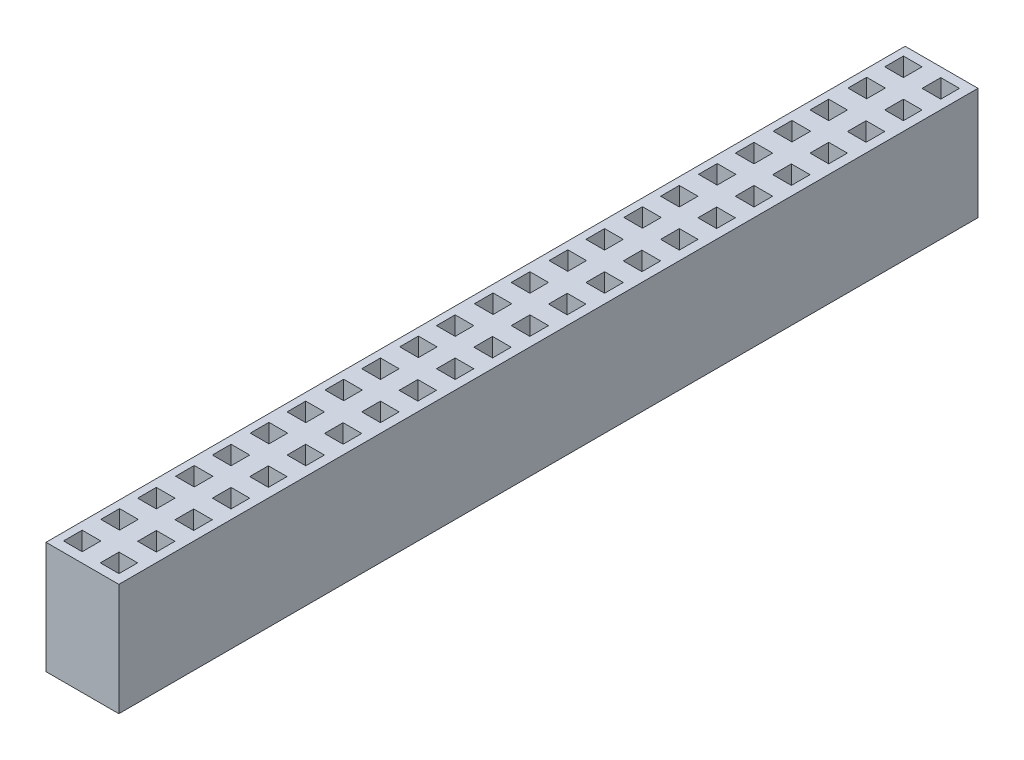
from build123d import *

# Parameters (mm, degrees)
SKETCH1_W           = 4.953
SKETCH1_H           = 58.42
SKETCH1_W_2         = 1.27
SKETCH1_H_2         = 1.27
BOSS_EXTRUDE1_DEPTH = 7.62


with BuildPart() as part:
    # Sketch1 → Boss-Extrude1 (new body)
    with BuildSketch(Plane(origin=(0, 0, 0), x_dir=(1, 0, 0), z_dir=(0, 1, 0))):
        with Locations((2.4765, 29.21)):
            Rectangle(SKETCH1_W, SKETCH1_H)
        with Locations((3.691399704, 57.15)):
            Rectangle(SKETCH1_W_2, SKETCH1_H_2, mode=Mode.SUBTRACT)
        with Locations((1.151399704, 57.15)):
            Rectangle(SKETCH1_W_2, SKETCH1_H_2, mode=Mode.SUBTRACT)
        with Locations((3.691399704, 54.61)):
            Rectangle(SKETCH1_W_2, SKETCH1_H_2, mode=Mode.SUBTRACT)
        with Locations((1.151399704, 54.648853122)):
            Rectangle(SKETCH1_W_2, SKETCH1_H_2, mode=Mode.SUBTRACT)
        with Locations((3.691399704, 52.07)):
            Rectangle(SKETCH1_W_2, SKETCH1_H_2, mode=Mode.SUBTRACT)
        with Locations((1.151399704, 52.07)):
            Rectangle(SKETCH1_W_2, SKETCH1_H_2, mode=Mode.SUBTRACT)
        with Locations((3.691399704, 49.53)):
            Rectangle(SKETCH1_W_2, SKETCH1_H_2, mode=Mode.SUBTRACT)
        with Locations((1.151399704, 49.568853122)):
            Rectangle(SKETCH1_W_2, SKETCH1_H_2, mode=Mode.SUBTRACT)
        with Locations((3.691399704, 46.99)):
            Rectangle(SKETCH1_W_2, SKETCH1_H_2, mode=Mode.SUBTRACT)
        with Locations((1.151399704, 46.99)):
            Rectangle(SKETCH1_W_2, SKETCH1_H_2, mode=Mode.SUBTRACT)
        with Locations((3.691399704, 44.45)):
            Rectangle(SKETCH1_W_2, SKETCH1_H_2, mode=Mode.SUBTRACT)
        with Locations((1.151399704, 44.488853122)):
            Rectangle(SKETCH1_W_2, SKETCH1_H_2, mode=Mode.SUBTRACT)
        with Locations((3.691399704, 41.91)):
            Rectangle(SKETCH1_W_2, SKETCH1_H_2, mode=Mode.SUBTRACT)
        with Locations((1.151399704, 41.91)):
            Rectangle(SKETCH1_W_2, SKETCH1_H_2, mode=Mode.SUBTRACT)
        with Locations((3.691399704, 39.37)):
            Rectangle(SKETCH1_W_2, SKETCH1_H_2, mode=Mode.SUBTRACT)
        with Locations((1.151399704, 39.408853122)):
            Rectangle(SKETCH1_W_2, SKETCH1_H_2, mode=Mode.SUBTRACT)
        with Locations((3.691399704, 36.83)):
            Rectangle(SKETCH1_W_2, SKETCH1_H_2, mode=Mode.SUBTRACT)
        with Locations((1.151399704, 36.83)):
            Rectangle(SKETCH1_W_2, SKETCH1_H_2, mode=Mode.SUBTRACT)
        with Locations((3.691399704, 34.29)):
            Rectangle(SKETCH1_W_2, SKETCH1_H_2, mode=Mode.SUBTRACT)
        with Locations((1.151399704, 34.328853122)):
            Rectangle(SKETCH1_W_2, SKETCH1_H_2, mode=Mode.SUBTRACT)
        with Locations((3.691399704, 31.75)):
            Rectangle(SKETCH1_W_2, SKETCH1_H_2, mode=Mode.SUBTRACT)
        with Locations((1.151399704, 31.75)):
            Rectangle(SKETCH1_W_2, SKETCH1_H_2, mode=Mode.SUBTRACT)
        with Locations((3.691399704, 29.21)):
            Rectangle(SKETCH1_W_2, SKETCH1_H_2, mode=Mode.SUBTRACT)
        with Locations((1.151399704, 29.248853122)):
            Rectangle(SKETCH1_W_2, SKETCH1_H_2, mode=Mode.SUBTRACT)
        with Locations((3.691399704, 26.67)):
            Rectangle(SKETCH1_W_2, SKETCH1_H_2, mode=Mode.SUBTRACT)
        with Locations((1.151399704, 26.67)):
            Rectangle(SKETCH1_W_2, SKETCH1_H_2, mode=Mode.SUBTRACT)
        with Locations((3.691399704, 24.13)):
            Rectangle(SKETCH1_W_2, SKETCH1_H_2, mode=Mode.SUBTRACT)
        with Locations((1.151399704, 24.168853122)):
            Rectangle(SKETCH1_W_2, SKETCH1_H_2, mode=Mode.SUBTRACT)
        with Locations((3.691399704, 21.59)):
            Rectangle(SKETCH1_W_2, SKETCH1_H_2, mode=Mode.SUBTRACT)
        with Locations((1.151399704, 21.59)):
            Rectangle(SKETCH1_W_2, SKETCH1_H_2, mode=Mode.SUBTRACT)
        with Locations((3.691399704, 19.05)):
            Rectangle(SKETCH1_W_2, SKETCH1_H_2, mode=Mode.SUBTRACT)
        with Locations((1.151399704, 19.088853122)):
            Rectangle(SKETCH1_W_2, SKETCH1_H_2, mode=Mode.SUBTRACT)
        with Locations((3.691399704, 16.51)):
            Rectangle(SKETCH1_W_2, SKETCH1_H_2, mode=Mode.SUBTRACT)
        with Locations((1.151399704, 16.51)):
            Rectangle(SKETCH1_W_2, SKETCH1_H_2, mode=Mode.SUBTRACT)
        with Locations((3.691399704, 13.97)):
            Rectangle(SKETCH1_W_2, SKETCH1_H_2, mode=Mode.SUBTRACT)
        with Locations((1.151399704, 14.008853122)):
            Rectangle(SKETCH1_W_2, SKETCH1_H_2, mode=Mode.SUBTRACT)
        with Locations((3.691399704, 11.43)):
            Rectangle(SKETCH1_W_2, SKETCH1_H_2, mode=Mode.SUBTRACT)
        with Locations((1.151399704, 11.43)):
            Rectangle(SKETCH1_W_2, SKETCH1_H_2, mode=Mode.SUBTRACT)
        with Locations((3.691399704, 8.89)):
            Rectangle(SKETCH1_W_2, SKETCH1_H_2, mode=Mode.SUBTRACT)
        with Locations((1.151399704, 8.928853122)):
            Rectangle(SKETCH1_W_2, SKETCH1_H_2, mode=Mode.SUBTRACT)
        with Locations((3.691399704, 6.35)):
            Rectangle(SKETCH1_W_2, SKETCH1_H_2, mode=Mode.SUBTRACT)
        with Locations((1.151399704, 6.35)):
            Rectangle(SKETCH1_W_2, SKETCH1_H_2, mode=Mode.SUBTRACT)
        with Locations((3.691399704, 3.81)):
            Rectangle(SKETCH1_W_2, SKETCH1_H_2, mode=Mode.SUBTRACT)
        with Locations((1.151399704, 3.848853122)):
            Rectangle(SKETCH1_W_2, SKETCH1_H_2, mode=Mode.SUBTRACT)
        with Locations((3.691399704, 1.27)):
            Rectangle(SKETCH1_W_2, SKETCH1_H_2, mode=Mode.SUBTRACT)
        with Locations((1.151399704, 1.308853122)):
            Rectangle(SKETCH1_W_2, SKETCH1_H_2, mode=Mode.SUBTRACT)
    extrude(amount=BOSS_EXTRUDE1_DEPTH)


solid = part.part
